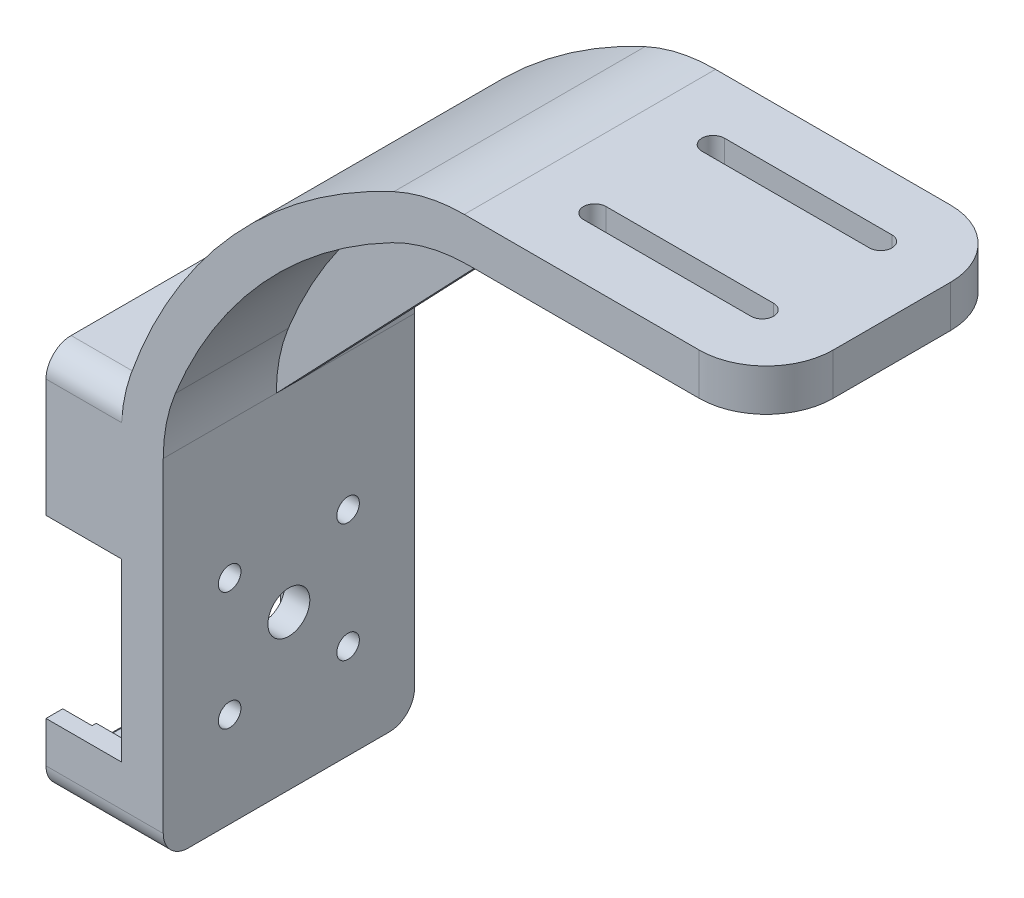
from build123d import *

# Parameters (mm, degrees)
SALIENTE_EXTRUIR1_DEPTH      = 30
CORTAR_EXTRUIR1_DEPTH        = 5
CROQUIS3_W                   = 30
CROQUIS3_H                   = 25
CORTAR_EXTRUIR2_DEPTH        = 2
CROQUIS4_R                   = 1.35
CROQUIS4_R_2                 = 2.5
CORTAR_EXTRUIR3_DEPTH        = 5
CROQUIS5_W                   = 25
CROQUIS5_H                   = 25
CORTAR_EXTRUIR4_DEPTH        = 2
REDONDEO2_R                  = 20
REDONDEO3_R                  = 8
REDONDEO4_R                  = 2
SALIENTE_EXTRUIR2_DEPTH      = 9
SALIENTE_EXTRUIR2_DEPTH_BACK = 1
CORTAR_EXTRUIR5_START        = 9
CROQUIS10_W                  = 26
CROQUIS10_H                  = 14.6
CORTAR_EXTRUIR5_DEPTH        = 5
SALIENTE_EXTRUIR3_START      = 4
CROQUIS12_R                  = 3.6
CROQUIS12_R_2                = 2.1
SALIENTE_EXTRUIR3_DEPTH      = 3
CORTAR_EXTRUIR7_START        = -2
CROQUIS13_R                  = 2.1
CORTAR_EXTRUIR7_DEPTH        = 5
CORTAR_EXTRUIR8_START        = 9
CROQUIS14_W                  = 26
CROQUIS14_H                  = 5.4
CORTAR_EXTRUIR8_DEPTH        = 3.5
REDONDEO5_R                  = 3
SALIENTE_EXTRUIR4_DEPTH      = 1.5
SALIENTE_EXTRUIR4_DEPTH_BACK = 1.5
SALIENTE_EXTRUIR4_START      = -15


with BuildPart() as part:
    # Croquis1 → Saliente-Extruir1 (new body)
    with BuildSketch(Plane.XY):
        with BuildLine():
            Line((7, 0), (7, 5))
            Line((7, 5), (-33, 5))
            ThreePointArc((-33, 5), (-56.296113, -10.563595), (-70, -35))
            Line((-70, -35), (-70, -80))
            Line((-70, -80), (-65, -80))
            Line((-65, -80), (-65, -34.805195))
            ThreePointArc((-65, -34.805195), (-52.819114, -13.779819), (-32.805195, 0))
            Line((-32.805195, 0), (7, 0))
        make_face()
    extrude(amount=SALIENTE_EXTRUIR1_DEPTH)

    # Croquis2 → Cortar-Extruir1 (cut)
    with BuildSketch(Plane(origin=(0, 5, 0), x_dir=(1, 0, 0), z_dir=(0, 1, 0))):
        with BuildLine():
            Line((-11.4, -6.58), (-1.4, -6.58))
            ThreePointArc((-1.4, -6.58), (-0.05, -7.93), (-1.4, -9.28))
            Line((-1.4, -9.28), (-21.400001, -9.28))
            ThreePointArc((-21.400001, -9.28), (-22.75, -7.93), (-21.4, -6.58))
            Line((-21.4, -6.58), (-11.4, -6.58))
        make_face()
        with BuildLine():
            Line((-1.4, -20.72), (-21.400001, -20.72))
            ThreePointArc((-21.400001, -20.72), (-22.75, -22.07), (-21.4, -23.42))
            Line((-21.4, -23.42), (-11.4, -23.42))
            Line((-11.4, -23.42), (-1.4, -23.42))
            ThreePointArc((-1.4, -23.42), (-0.05, -22.07), (-1.4, -20.72))
        make_face()
    extrude(amount=-CORTAR_EXTRUIR1_DEPTH, mode=Mode.SUBTRACT)

    # Croquis3 → Cortar-Extruir2 (cut)
    with BuildSketch(Plane.XZ):
        with Locations((-11.4, 15)):
            Rectangle(CROQUIS3_W, CROQUIS3_H)
    extrude(amount=-CORTAR_EXTRUIR2_DEPTH, mode=Mode.SUBTRACT)

    # Croquis4 → Cortar-Extruir3 (cut)
    with BuildSketch(Plane.ZY.offset(70)):
        with Locations((22.071068, -54.528932)):
            Circle(CROQUIS4_R)
        with Locations((22.071068, -68.671068)):
            Circle(CROQUIS4_R)
        with Locations((7.928932, -68.671068)):
            Circle(CROQUIS4_R)
        with Locations((7.928932, -54.528932)):
            Circle(CROQUIS4_R)
        with Locations((15, -61.6)):
            Circle(CROQUIS4_R_2)
    extrude(amount=-CORTAR_EXTRUIR3_DEPTH, mode=Mode.SUBTRACT)

    # Croquis5 → Cortar-Extruir4 (cut)
    with BuildSketch(Plane.ZY.offset(70)):
        with Locations((15, -61.6)):
            Rectangle(CROQUIS5_W, CROQUIS5_H)
    extrude(amount=-CORTAR_EXTRUIR4_DEPTH, mode=Mode.SUBTRACT)

    # Redondeo2
    redondeo2_edges = [part.edges().sort_by_distance(p)[0] for p in [
        (-32.805195, 0, 15),
        (-65, -34.805195, 15),
        (-70, -35, 15),
        (-33, 5, 15),
    ]]
    fillet(redondeo2_edges, radius=REDONDEO2_R)

    # Redondeo3
    redondeo3_edges = [part.edges().sort_by_distance(p)[0] for p in [
        (7, 2.5, 0),
        (7, 2.5, 30),
    ]]
    fillet(redondeo3_edges, radius=REDONDEO3_R)

    # Redondeo4
    redondeo4_edges = [part.edges().sort_by_distance(p)[0] for p in [
        (-69, -49.1, 27.5),
        (-69, -74.1, 27.5),
        (-69, -74.1, 2.5),
        (-69, -49.1, 2.5),
        (3.6, 1, 27.5),
        (3.6, 1, 2.5),
        (-26.4, 1, 2.5),
        (-26.4, 1, 27.5),
    ]]
    fillet(redondeo4_edges, radius=REDONDEO4_R)

    # Croquis8 → Saliente-Extruir2 (add, two sides: drawn at the far end of the back side and taken through both)
    with BuildSketch(Plane.ZY.offset(70).offset(-SALIENTE_EXTRUIR2_DEPTH_BACK)):
        with BuildLine():
            Line((2.5, -72.1), (0, -72.1))
            Line((0, -72.1), (0, -80))
            Line((0, -80), (30, -80))
            Line((30, -80), (30, -72.1))
            Line((30, -72.1), (27.5, -72.1))
            ThreePointArc((27.5, -72.1), (26.914214, -73.514214), (25.5, -74.1))
            Line((25.5, -74.1), (4.5, -74.1))
            ThreePointArc((4.5, -74.1), (3.085786, -73.514214), (2.5, -72.1))
        make_face()
        with BuildLine():
            Line((2.5, -51.1), (0, -51.1))
            Line((0, -51.1), (0, -34))
            Line((0, -34), (30, -34))
            Line((30, -34), (30, -51.1))
            Line((30, -51.1), (27.5, -51.1))
            ThreePointArc((27.5, -51.1), (26.914214, -49.685786), (25.5, -49.1))
            Line((25.5, -49.1), (4.5, -49.1))
            ThreePointArc((4.5, -49.1), (3.085786, -49.685786), (2.5, -51.1))
        make_face()
    extrude(amount=SALIENTE_EXTRUIR2_DEPTH + SALIENTE_EXTRUIR2_DEPTH_BACK)

    # Croquis10 → Cortar-Extruir5 (cut)
    with BuildSketch(Plane.ZY.offset(70).offset(CORTAR_EXTRUIR5_START)):
        with Locations((15, -43.8)):
            Rectangle(CROQUIS10_W, CROQUIS10_H)
    extrude(amount=-CORTAR_EXTRUIR5_DEPTH, mode=Mode.SUBTRACT)

    # Croquis12 → Saliente-Extruir3 (add)
    with BuildSketch(Plane.ZY.offset(70).offset(SALIENTE_EXTRUIR3_START)):
        with Locations((5.5, -45.5)):
            Circle(CROQUIS12_R)
        with Locations(Location((5.5, -45.5, 0), (0, 0, 180))):
            Circle(CROQUIS12_R_2, mode=Mode.SUBTRACT)
    extrude(amount=SALIENTE_EXTRUIR3_DEPTH)

    # Croquis13 → Cortar-Extruir7 (cut)
    with BuildSketch(Plane.ZY.offset(74).offset(CORTAR_EXTRUIR7_START)):
        with Locations(Location((5.5, -45.5, 0), (0, 0, 180))):
            Circle(CROQUIS13_R)
    extrude(amount=CORTAR_EXTRUIR7_DEPTH, mode=Mode.SUBTRACT)

    # Croquis14 → Cortar-Extruir8 (cut)
    with BuildSketch(Plane.ZY.offset(70).offset(CORTAR_EXTRUIR8_START)):
        with Locations((15, -74.8)):
            Rectangle(CROQUIS14_W, CROQUIS14_H)
    extrude(amount=-CORTAR_EXTRUIR8_DEPTH, mode=Mode.SUBTRACT)

    # Redondeo5
    redondeo5_edges = [part.edges().sort_by_distance(p)[0] for p in [
        (-72, -80, 30),
        (-74.291633, -34, 30),
        (-74.291633, -34, 0),
        (-72, -80, 0),
    ]]
    fillet(redondeo5_edges, radius=REDONDEO5_R)

    # Croquis15 → Saliente-Extruir4 (add, two sides: drawn at the far end of the back side and taken through both)
    with BuildSketch(Plane.XY.offset(30).offset(SALIENTE_EXTRUIR4_START - SALIENTE_EXTRUIR4_DEPTH_BACK)):
        with BuildLine():
            Line((-65, -38.217888), (-28.4904, 0))
            ThreePointArc((-28.4904, 0), (-33.236938, -0.571403), (-37.712257, -2.252962))
            ThreePointArc((-37.712257, -2.252962), (-53.200641, -14.196528), (-63.566437, -30.782337))
            ThreePointArc((-63.566437, -30.782337), (-64.638339, -34.431646), (-65, -38.217888))
        make_face()
    extrude(amount=SALIENTE_EXTRUIR4_DEPTH + SALIENTE_EXTRUIR4_DEPTH_BACK)


solid = part.part
